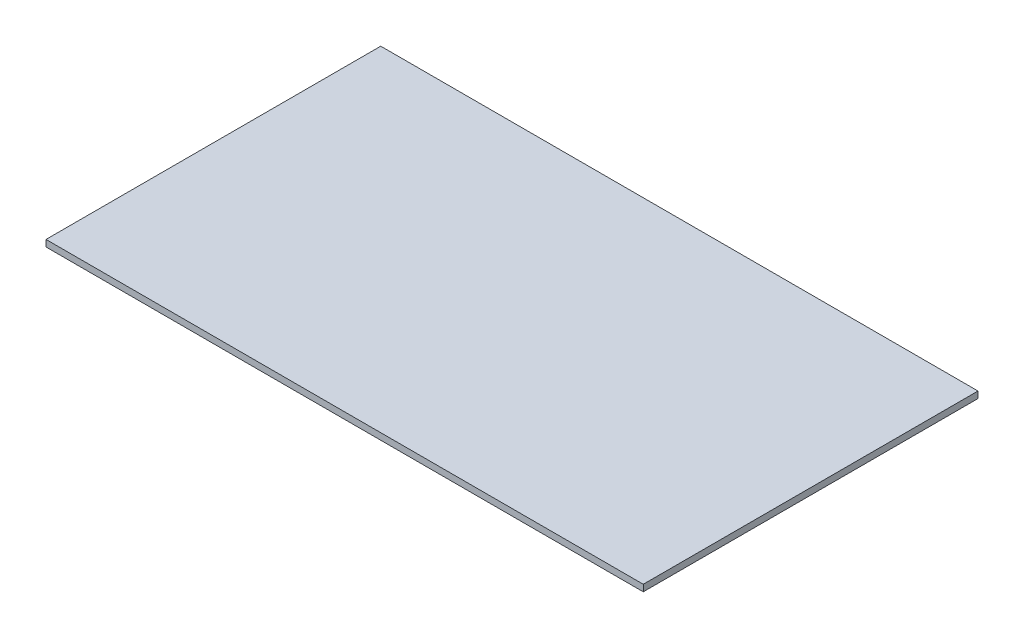
from build123d import *

# Parameters (mm, degrees)
SKETCH1_W           = 455
SKETCH1_H           = 255
BOSS_EXTRUDE1_DEPTH = 5


with BuildPart() as part:
    # Sketch1 → Boss-Extrude1 (new body)
    with BuildSketch(Plane(origin=(0, 0, 0), x_dir=(1, 0, 0), z_dir=(0, 1, 0))):
        Rectangle(SKETCH1_W, SKETCH1_H)
    extrude(amount=BOSS_EXTRUDE1_DEPTH)


solid = part.part
